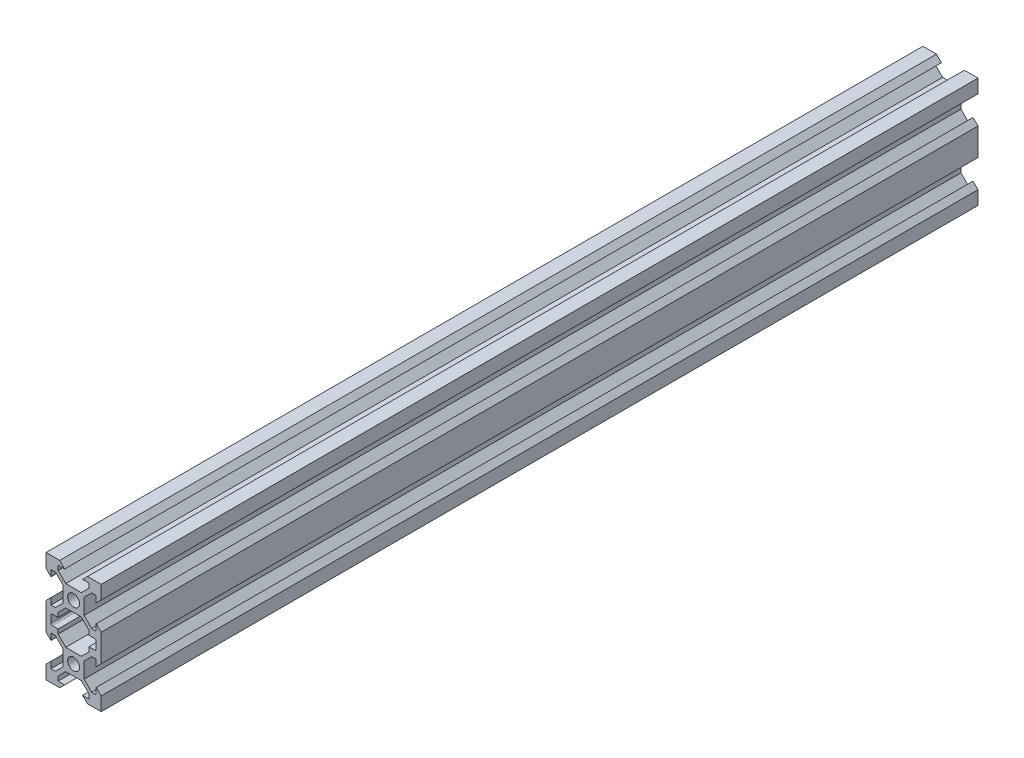
from build123d import *

# Parameters (mm, degrees)
CROQUIS1_R              = 2.15
SALIENTE_EXTRUIR1_DEPTH = 318


with BuildPart() as part:
    # Croquis1 → Saliente-Extruir1 (new body)
    with BuildSketch(Plane.XY):
        Polygon((20, 4.95), (18.2, 6.75), (18.2, 4.4), (16.589949494, 4.4), (13.825, 7.164949494), (13.825, 12.835050506), (16.589949494, 15.6), (18.2, 15.6), (18.2, 13.25), (20, 15.05), (20, 20), (15.05, 20), (13.25, 18.2), (15.6, 18.2), (15.6, 16.589949494), (12.835050506, 13.825), (7.164949494, 13.825), (4.4, 16.589949494), (4.4, 18.2), (6.75, 18.2), (4.95, 20), (0, 20), (0, 15.05), (1.8, 13.25), (1.8, 15.6), (3.410050506, 15.6), (6.175, 12.835050506), (6.175, 7.164949494), (3.410050506, 4.4), (1.8, 4.4), (1.8, 6.75), (0, 4.95), (0, -4.95), (1.8, -6.75), (1.8, -4.4), (3.410050506, -4.4), (6.175, -7.164949494), (6.175, -12.835050506), (3.410050506, -15.6), (1.8, -15.6), (1.8, -13.25), (0, -15.05), (0, -20), (4.95, -20), (6.75, -18.2), (4.4, -18.2), (4.4, -16.589949494), (7.164949494, -13.825), (12.835050506, -13.825), (15.6, -16.589949494), (15.6, -18.2), (13.25, -18.2), (15.05, -20), (20, -20), (20, -15.05), (18.2, -13.25), (18.2, -15.6), (16.589949494, -15.6), (13.825, -12.835050506), (13.825, -7.164949494), (16.589949494, -4.4), (18.2, -4.4), (18.2, -6.75), (20, -4.95), align=None)
        with BuildLine():
            Line((1.8, -1.3), (1.8, 1.3))
            ThreePointArc((1.8, 1.3), (1.946446609, 1.653553391), (2.3, 1.8))
            Line((2.3, 1.8), (4.4, 1.8))
            Line((4.4, 1.8), (4.4, 3.410050506))
            Line((4.4, 3.410050506), (7.164949494, 6.175))
            Line((7.164949494, 6.175), (12.835050506, 6.175))
            Line((12.835050506, 6.175), (15.6, 3.410050506))
            Line((15.6, 3.410050506), (15.6, 1.8))
            Line((15.6, 1.8), (17.7, 1.8))
            ThreePointArc((17.7, 1.8), (18.053553391, 1.653553391), (18.2, 1.3))
            Line((18.2, 1.3), (18.2, -1.3))
            ThreePointArc((18.2, -1.3), (18.053553391, -1.653553391), (17.7, -1.8))
            Line((17.7, -1.8), (15.6, -1.8))
            Line((15.6, -1.8), (15.6, -3.410050506))
            Line((15.6, -3.410050506), (12.835050506, -6.175))
            Line((12.835050506, -6.175), (7.164949494, -6.175))
            Line((7.164949494, -6.175), (4.4, -3.410050506))
            Line((4.4, -3.410050506), (4.4, -1.8))
            Line((4.4, -1.8), (2.3, -1.8))
            ThreePointArc((2.3, -1.8), (1.946446609, -1.653553391), (1.8, -1.3))
        make_face(mode=Mode.SUBTRACT)
        with Locations(Location((10, -10, 0), (0, 0, 180))):
            Circle(CROQUIS1_R, mode=Mode.SUBTRACT)
        with Locations(Location((10, 10, 0), (0, 0, 180))):
            Circle(CROQUIS1_R, mode=Mode.SUBTRACT)
    extrude(amount=SALIENTE_EXTRUIR1_DEPTH)


solid = part.part
